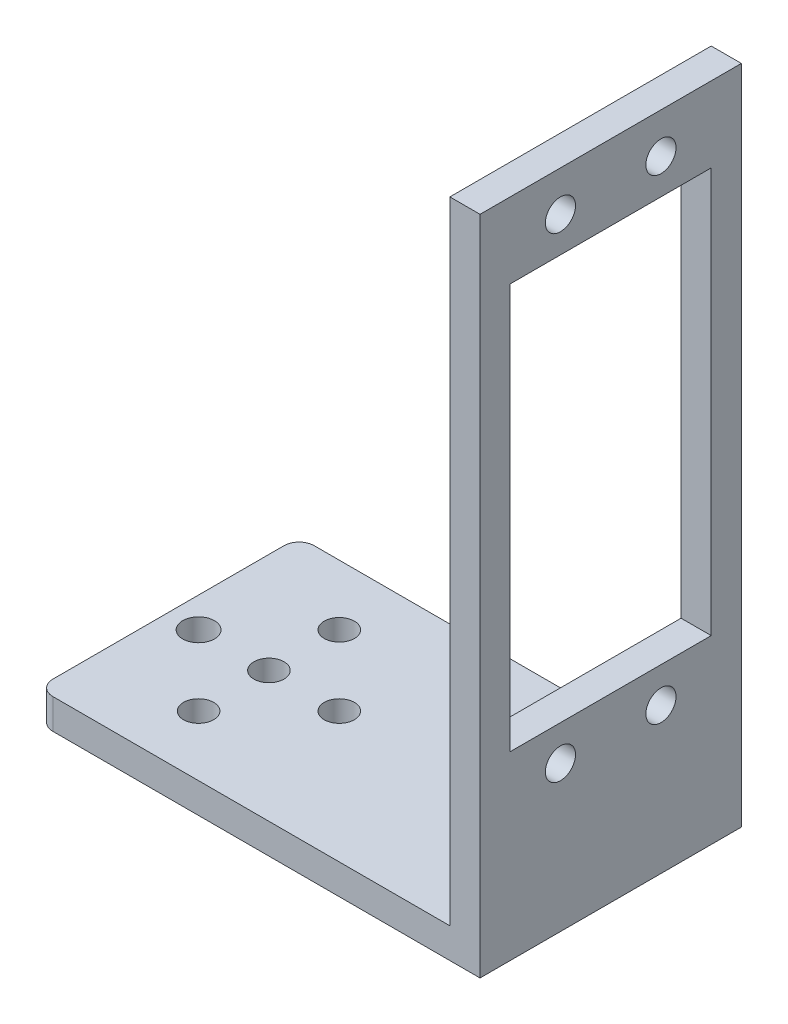
from build123d import *

# Parameters (mm, degrees)
CROQUIS1_R              = 1.5
CROQUIS1_R_2            = 1.58
SALIENTE_EXTRUIR1_DEPTH = 3
CROQUIS2_W              = 3
CROQUIS2_H              = 26
SALIENTE_EXTRUIR2_DEPTH = 15
CROQUIS3_R              = 1.5
CORTAR_EXTRUIR1_DEPTH   = 15
CROQUIS4_W              = 3
CROQUIS4_H              = 3
SALIENTE_EXTRUIR3_DEPTH = 40.3
CROQUIS5_W              = 3
CROQUIS5_H              = 26
SALIENTE_EXTRUIR5_DEPTH = 7.5
CROQUIS6_R              = 1.5
CORTAR_EXTRUIR2_DEPTH   = 7.5


with BuildPart() as part:
    # Croquis1 → Saliente-Extruir1 (new body)
    with BuildSketch(Plane(origin=(0, 0, 0), x_dir=(1, 0, 0), z_dir=(0, 1, 0))):
        with BuildLine():
            Line((0, 1.5), (0, 24.5))
            ThreePointArc((0, 24.5), (0.439339828, 25.560660172), (1.5, 26))
            Line((1.5, 26), (44, 26))
            Line((44, 26), (44, 0))
            Line((44, 0), (1.5, 0))
            ThreePointArc((1.5, 0), (0.439339828, 0.439339828), (0, 1.5))
        make_face()
        with Locations(Location((10, 13, 0), (0, 0, 270))):
            Circle(CROQUIS1_R, mode=Mode.SUBTRACT)
        with Locations(Location((17, 13, 0), (0, 0, 270))):
            Circle(CROQUIS1_R, mode=Mode.SUBTRACT)
        with Locations(Location((10, 20, 0), (0, 0, 270))):
            Circle(CROQUIS1_R, mode=Mode.SUBTRACT)
        with Locations(Location((10, 6, 0), (0, 0, 270))):
            Circle(CROQUIS1_R, mode=Mode.SUBTRACT)
        with Locations(Location((3, 13, 0), (0, 0, 270))):
            Circle(CROQUIS1_R_2, mode=Mode.SUBTRACT)
    extrude(amount=SALIENTE_EXTRUIR1_DEPTH)

    # Croquis2 → Saliente-Extruir2 (add)
    with BuildSketch(Plane(origin=(0, 3, 0), x_dir=(1, 0, 0), z_dir=(0, 1, 0))):
        with Locations((42.5, 13)):
            Rectangle(CROQUIS2_W, CROQUIS2_H)
    extrude(amount=SALIENTE_EXTRUIR2_DEPTH)

    # Croquis3 → Cortar-Extruir1 (cut)
    with BuildSketch(Plane.ZY.offset(-41)):
        with Locations((-18, 14.5)):
            Circle(CROQUIS3_R)
        with Locations((-8, 14.5)):
            Circle(CROQUIS3_R)
    extrude(amount=-CORTAR_EXTRUIR1_DEPTH, mode=Mode.SUBTRACT)

    # Croquis4 → Saliente-Extruir3 (add)
    with BuildSketch(Plane(origin=(0, 18, 0), x_dir=(1, 0, 0), z_dir=(0, 1, 0))):
        with Locations((42.5, 24.5)):
            Rectangle(CROQUIS4_W, CROQUIS4_H)
        with Locations((42.5, 1.5)):
            Rectangle(CROQUIS4_W, CROQUIS4_H)
    extrude(amount=SALIENTE_EXTRUIR3_DEPTH)

    # Croquis5 → Saliente-Extruir5 (add)
    with BuildSketch(Plane(origin=(0, 58.3, 0), x_dir=(1, 0, 0), z_dir=(0, 1, 0))):
        with Locations((42.5, 13)):
            Rectangle(CROQUIS5_W, CROQUIS5_H)
    extrude(amount=SALIENTE_EXTRUIR5_DEPTH)

    # Croquis6 → Cortar-Extruir2 (cut)
    with BuildSketch(Plane.ZY.offset(-41)):
        with Locations((-18, 61.8)):
            Circle(CROQUIS6_R)
        with Locations((-8, 61.8)):
            Circle(CROQUIS6_R)
    extrude(amount=-CORTAR_EXTRUIR2_DEPTH, mode=Mode.SUBTRACT)


solid = part.part
